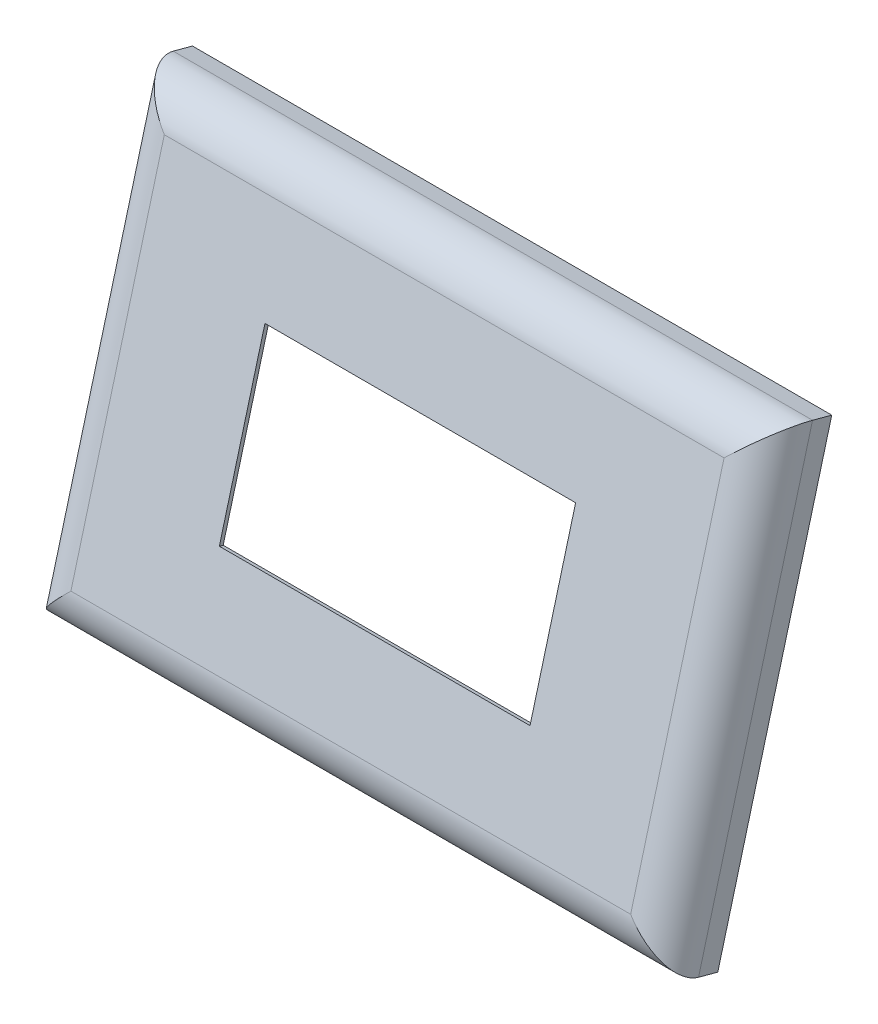
from build123d import *

# Parameters (mm, degrees)
SKETCH1_W           = 321.435935394
SKETCH1_H           = 221.435935394
BOSS_EXTRUDE1_DEPTH = 30
FILLET1_R           = 20
SHELL1_T            = -2
CUT_EXTRUDE1_REACH  = 1355.856
SKETCH2_W           = 156.2
SKETCH2_H           = 88.6
SKETCH5_R           = 5
SKETCH5_R_2         = 1.5
BOSS_EXTRUDE2_DEPTH = 20
FILLET2_R           = 5


with BuildPart() as part:
    # Sketch1 → Boss-Extrude1 (new body)
    with BuildSketch(Plane(origin=(0, -69.673086457, -260.023498579), x_dir=(1, 0, 0), z_dir=(0, 0.2588190451025214, 0.9659258262890682))):
        with Locations((1020.211286357, 547.548055232)):
            Rectangle(SKETCH1_W, SKETCH1_H)
    extrude(amount=BOSS_EXTRUDE1_DEPTH)

    # Fillet1
    fillet1_edges = [part.edges().sort_by_distance(p)[0] for p in [
        (859.49331866, 466.982292579, -372.761588593),
        (1020.211286357, 360.036948146, -344.105669918),
        (1180.929254054, 466.982292579, -372.761588593),
        (1020.211286357, 573.927637012, -401.417507268),
    ]]
    fillet(fillet1_edges, radius=FILLET1_R)

    # Shell1
    shell1_openings = [part.faces().sort_by_distance(p)[0] for p in [
        (1020.211286357, 459.217721226, -401.739363381),
    ]]
    offset(amount=SHELL1_T, openings=shell1_openings)

    # Sketch2 → Cut-Extrude1 (cut, up to next)
    with BuildSketch(Plane(origin=(0, -61.908515104, -231.04572379), x_dir=(1, 0, 0), z_dir=(0, 0.2588190451025213, 0.9659258262890681)), mode=Mode.PRIVATE) as cut_extrude1_sk1:
        with Locations((1020.211286357, 547.548055232)):
            Rectangle(SKETCH2_W, SKETCH2_H)
    cut_extrude1_tool1 = extrude(cut_extrude1_sk1.sketch, amount=-CUT_EXTRUDE1_REACH, mode=Mode.PRIVATE) & part.part
    add(cut_extrude1_tool1.solids().sort_by_distance((1020.211286, 466.982293, -372.761589))[0], mode=Mode.SUBTRACT)

    # Sketch5 → Boss-Extrude2 (add)
    # profile 1 of 4: a face of its own
    with BuildSketch(Plane(origin=(0, -62.426153194, -232.977575442), x_dir=(-1, 0, 0), z_dir=(0, -0.25881904510252146, -0.9659258262890681))):
        with Locations(Location((-901.394461057, 616.364880532, 0), (0, 0, 270))):
            Circle(SKETCH5_R)
        with Locations(Location((-901.394461057, 616.364880532, 0), (0, 0, 90))):
            Circle(SKETCH5_R_2, mode=Mode.SUBTRACT)
    # profile 2 of 4: a face of its own
    with BuildSketch(Plane(origin=(0, -62.426153194, -232.977575442), x_dir=(-1, 0, 0), z_dir=(0, -0.25881904510252146, -0.9659258262890681))):
        with Locations(Location((-901.394461057, 478.731229931, 0), (0, 0, 270))):
            Circle(SKETCH5_R)
        with Locations(Location((-901.394461057, 478.731229931, 0), (0, 0, 90))):
            Circle(SKETCH5_R_2, mode=Mode.SUBTRACT)
    # profile 3 of 4: a face of its own
    with BuildSketch(Plane(origin=(0, -62.426153194, -232.977575442), x_dir=(-1, 0, 0), z_dir=(0, -0.25881904510252146, -0.9659258262890681))):
        with Locations(Location((-1139.028111658, 478.731229931, 0), (0, 0, 270))):
            Circle(SKETCH5_R)
        with Locations(Location((-1139.028111658, 478.731229931, 0), (0, 0, 90))):
            Circle(SKETCH5_R_2, mode=Mode.SUBTRACT)
    # profile 4 of 4: a face of its own
    with BuildSketch(Plane(origin=(0, -62.426153194, -232.977575442), x_dir=(-1, 0, 0), z_dir=(0, -0.25881904510252146, -0.9659258262890681))):
        with Locations(Location((-1139.028111658, 616.364880532, 0), (0, 0, 270))):
            Circle(SKETCH5_R)
        with Locations(Location((-1139.028111658, 616.364880532, 0), (0, 0, 90))):
            Circle(SKETCH5_R_2, mode=Mode.SUBTRACT)
    extrude(amount=BOSS_EXTRUDE2_DEPTH)

    # Fillet2
    fillet2_edges = [part.edges().sort_by_distance(p)[0] for p in [
        (901.394461057, 537.766232461, -393.798640482),
        (901.394461057, 404.822334779, -358.17643046),
        (1139.028111658, 404.822334779, -358.17643046),
        (1139.028111658, 537.766232461, -393.798640482),
    ]]
    fillet(fillet2_edges, radius=FILLET2_R)


solid = part.part
